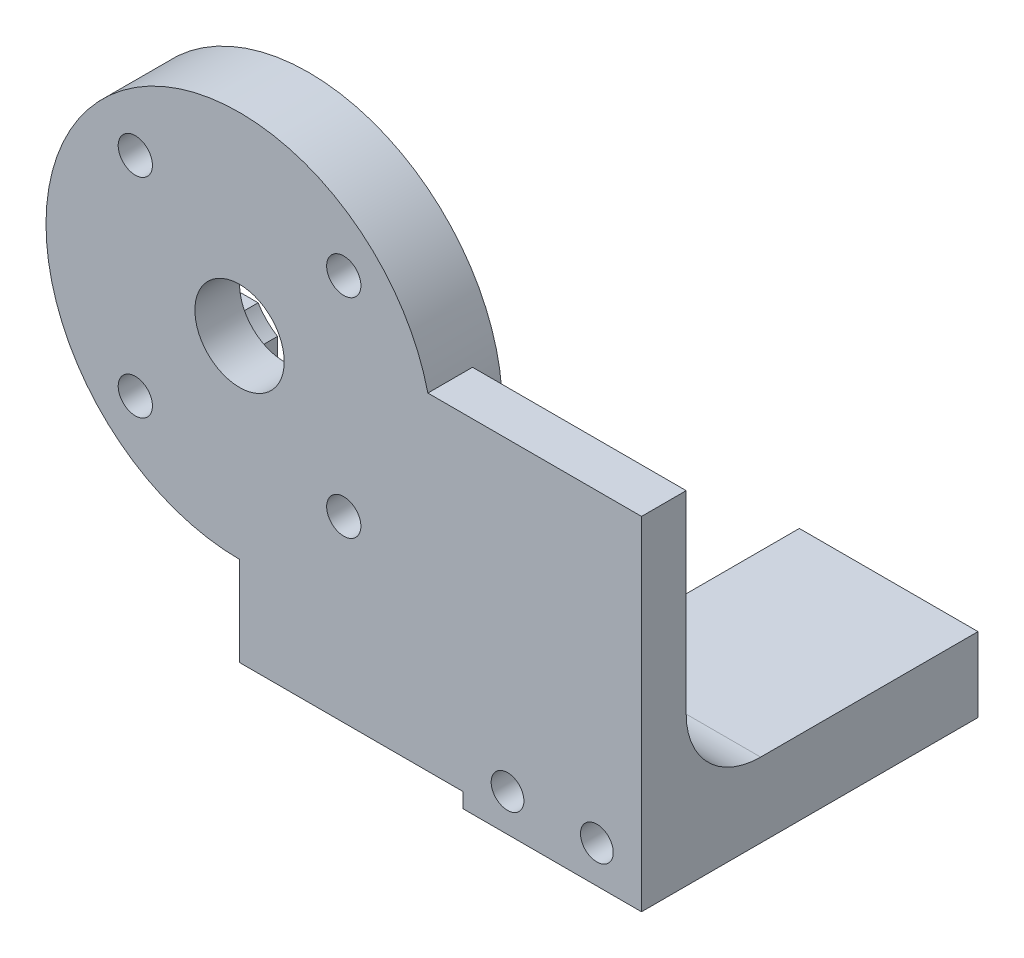
from build123d import *

# Parameters (mm, degrees)
STOCK_HORN_ATTACHMENT_START          = 19.6
STOCK_HORN_ATTACHMENT_PROFILE_R      = 13
STOCK_HORN_ATTACHMENT_DEPTH          = 3
FINGER_ARM_START                     = 19.6
FINGER_ARM_PROFILE_W                 = 27
FINGER_ARM_PROFILE_H                 = 22
FINGER_ARM_DEPTH                     = 3
DESCENDING_CONTACT_FINGER_PROFILE_W  = 12
DESCENDING_CONTACT_FINGER_PROFILE_H  = 5
DESCENDING_CONTACT_FINGER_DEPTH      = 22.6
HORN_CENTER_ACCESS_START             = -50
HORN_CENTER_ACCESS_PROFILE_R         = 3
HORN_CENTER_ACCESS_DEPTH             = 91.493950165
CAPTURED_HORN_KEY_BOSS_START         = 17.95
CAPTURED_HORN_KEY_BOSS_PROFILE_R     = 13
CAPTURED_HORN_KEY_BOSS_DEPTH         = 1.65
KEY_POCKET_HUB_START                 = 17.95
STOCK_HORN_POCKET_HUB_R              = 3.55
KEY_POCKET_HUB_DEPTH                 = 1.65
KEY_POCKET_HORIZONTAL_START          = 17.95
STOCK_HORN_POCKET_HORIZONTAL_W       = 16.3
STOCK_HORN_POCKET_HORIZONTAL_H       = 4.2
KEY_POCKET_HORIZONTAL_DEPTH          = 1.65
KEY_POCKET_VERTICAL_START            = 17.95
STOCK_HORN_POCKET_VERTICAL_W         = 4.2
STOCK_HORN_POCKET_VERTICAL_H         = 16.3
KEY_POCKET_VERTICAL_DEPTH            = 1.65
KEY_POCKET_ROUNDED_TIPS_START        = 17.95
STOCK_HORN_POCKET_ROUNDED_TIPS_R     = 2.1
KEY_POCKET_ROUNDED_TIPS_DEPTH        = 1.65
UNMODIFIED_HORN_CAPTURE_M2_START     = -50
UNMODIFIED_HORN_CAPTURE_M2_PROFILE_R = 1.15
UNMODIFIED_HORN_CAPTURE_M2_DEPTH     = 91.493950165
HUB_CLEARANCE_IN_KEY_BOSS_ONLY_START = 17.95
HORN_CENTER_HUB_CLEARANCE_R          = 4
HUB_CLEARANCE_IN_KEY_BOSS_ONLY_DEPTH = 1.65
CONTACT_PAD_KEEPER_START             = -50
CONTACT_PAD_KEEPER_PROFILE_R         = 1.1
CONTACT_PAD_KEEPER_DEPTH             = 91.493950165
FILLET1_R                            = 5


with BuildPart() as part:
    # Stock_horn_attachment_profile → Stock_horn_attachment (new body)
    with BuildSketch(Plane.XY.offset(STOCK_HORN_ATTACHMENT_START)):
        Circle(STOCK_HORN_ATTACHMENT_PROFILE_R)
    extrude(amount=STOCK_HORN_ATTACHMENT_DEPTH)

    # Finger_arm_profile → Finger_arm (add)
    with BuildSketch(Plane.XY.offset(FINGER_ARM_START)):
        with Locations((13.5, -8)):
            Rectangle(FINGER_ARM_PROFILE_W, FINGER_ARM_PROFILE_H)
    extrude(amount=FINGER_ARM_DEPTH)

    # Descending_contact_finger_profile → Descending_contact_finger (add)
    with BuildSketch(Plane.XY):
        with Locations((21, -17.5)):
            Rectangle(DESCENDING_CONTACT_FINGER_PROFILE_W, DESCENDING_CONTACT_FINGER_PROFILE_H)
    extrude(amount=DESCENDING_CONTACT_FINGER_DEPTH)

    # Horn_center_access_profile → Horn_center_access (cut, through all)
    with BuildSketch(Plane.XY.offset(HORN_CENTER_ACCESS_START)):
        Circle(HORN_CENTER_ACCESS_PROFILE_R)
    extrude(amount=HORN_CENTER_ACCESS_DEPTH, mode=Mode.SUBTRACT)

    # Captured_horn_key_boss_profile → Captured_horn_key_boss (add)
    with BuildSketch(Plane.XY.offset(CAPTURED_HORN_KEY_BOSS_START)):
        with Locations(Location((0, 0, 0), (0, 0, 270))):
            Circle(CAPTURED_HORN_KEY_BOSS_PROFILE_R)
    extrude(amount=CAPTURED_HORN_KEY_BOSS_DEPTH)

    # Stock_horn_pocket_Hub → Key_pocket_Hub (cut)
    with BuildSketch(Plane.XY.offset(KEY_POCKET_HUB_START)):
        Circle(STOCK_HORN_POCKET_HUB_R)
    extrude(amount=KEY_POCKET_HUB_DEPTH, mode=Mode.SUBTRACT)

    # Stock_horn_pocket_Horizontal → Key_pocket_Horizontal (cut)
    with BuildSketch(Plane.XY.offset(KEY_POCKET_HORIZONTAL_START)):
        Rectangle(STOCK_HORN_POCKET_HORIZONTAL_W, STOCK_HORN_POCKET_HORIZONTAL_H)
    extrude(amount=KEY_POCKET_HORIZONTAL_DEPTH, mode=Mode.SUBTRACT)

    # Stock_horn_pocket_Vertical → Key_pocket_Vertical (cut)
    with BuildSketch(Plane.XY.offset(KEY_POCKET_VERTICAL_START)):
        Rectangle(STOCK_HORN_POCKET_VERTICAL_W, STOCK_HORN_POCKET_VERTICAL_H)
    extrude(amount=KEY_POCKET_VERTICAL_DEPTH, mode=Mode.SUBTRACT)

    # Stock_horn_pocket_Rounded_tips → Key_pocket_Rounded_tips (cut)
    with BuildSketch(Plane.XY.offset(KEY_POCKET_ROUNDED_TIPS_START)):
        with Locations((8.15, 0)):
            Circle(STOCK_HORN_POCKET_ROUNDED_TIPS_R)
        with Locations((-8.15, 0)):
            Circle(STOCK_HORN_POCKET_ROUNDED_TIPS_R)
        with Locations((0, 8.15)):
            Circle(STOCK_HORN_POCKET_ROUNDED_TIPS_R)
        with Locations((0, -8.15)):
            Circle(STOCK_HORN_POCKET_ROUNDED_TIPS_R)
    extrude(amount=KEY_POCKET_ROUNDED_TIPS_DEPTH, mode=Mode.SUBTRACT)

    # Unmodified_horn_capture_M2_profile → Unmodified_horn_capture_M2 (cut, through all)
    with BuildSketch(Plane.XY.offset(UNMODIFIED_HORN_CAPTURE_M2_START)):
        with Locations((7, 7)):
            Circle(UNMODIFIED_HORN_CAPTURE_M2_PROFILE_R)
        with Locations((-7, 7)):
            Circle(UNMODIFIED_HORN_CAPTURE_M2_PROFILE_R)
        with Locations((-7, -7)):
            Circle(UNMODIFIED_HORN_CAPTURE_M2_PROFILE_R)
        with Locations((7, -7)):
            Circle(UNMODIFIED_HORN_CAPTURE_M2_PROFILE_R)
    extrude(amount=UNMODIFIED_HORN_CAPTURE_M2_DEPTH, mode=Mode.SUBTRACT)

    # Horn_center_hub_clearance → Hub_clearance_in_key_boss_only (cut)
    with BuildSketch(Plane.XY.offset(HUB_CLEARANCE_IN_KEY_BOSS_ONLY_START)):
        Circle(HORN_CENTER_HUB_CLEARANCE_R)
    extrude(amount=HUB_CLEARANCE_IN_KEY_BOSS_ONLY_DEPTH, mode=Mode.SUBTRACT)

    # Contact_pad_keeper_profile → Contact_pad_keeper (cut, through all)
    with BuildSketch(Plane.XY.offset(CONTACT_PAD_KEEPER_START)):
        with Locations(Location((18, -17.5, 0), (0, 0, 180))):
            Circle(CONTACT_PAD_KEEPER_PROFILE_R)
        with Locations(Location((24, -17.5, 0), (0, 0, 180))):
            Circle(CONTACT_PAD_KEEPER_PROFILE_R)
    extrude(amount=CONTACT_PAD_KEEPER_DEPTH, mode=Mode.SUBTRACT)

    # Fillet1
    fillet1_edges = [part.edges().sort_by_distance(p)[0] for p in [
        (21, -15, 19.6),
    ]]
    fillet(fillet1_edges, radius=FILLET1_R)


solid = part.part
